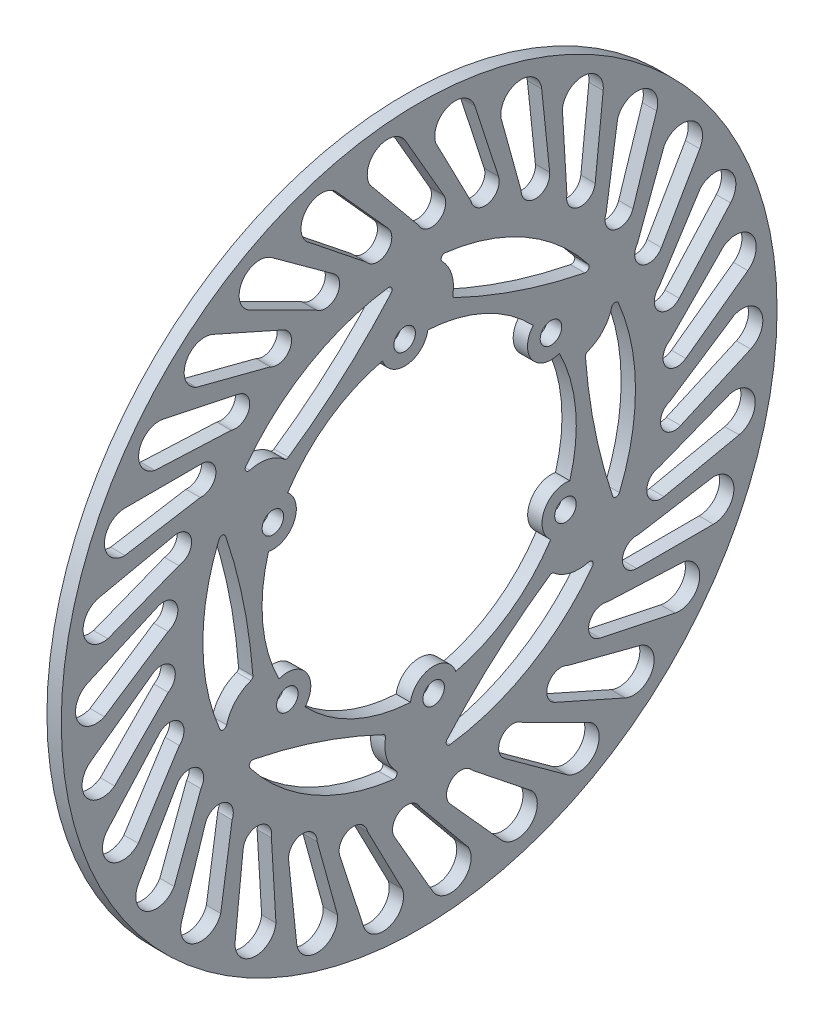
from build123d import *

# Parameters (mm, degrees)
SKETCH1_R           = 99.906578291
SKETCH1_R_2         = 3
BOSS_EXTRUDE1_DEPTH = 2


with BuildPart() as part:
    # Sketch1 → Boss-Extrude1 (new, symmetric)
    with BuildSketch(Plane(origin=(0, 0, 0), x_dir=(0, 0, -1), z_dir=(1, 0, 0))):
        Circle(SKETCH1_R)
        with Locations((-4.044070931, 44.817914837)):
            Circle(SKETCH1_R_2, mode=Mode.SUBTRACT)
        with Locations((36.791417327, 25.91122558)):
            Circle(SKETCH1_R_2, mode=Mode.SUBTRACT)
        with Locations((40.835488259, -18.906689257)):
            Circle(SKETCH1_R_2, mode=Mode.SUBTRACT)
        with Locations((4.044070931, -44.817914837)):
            Circle(SKETCH1_R_2, mode=Mode.SUBTRACT)
        with Locations((-36.791417327, -25.91122558)):
            Circle(SKETCH1_R_2, mode=Mode.SUBTRACT)
        with Locations((-40.835488259, 18.906689257)):
            Circle(SKETCH1_R_2, mode=Mode.SUBTRACT)
        with BuildLine():
            Line((68.395311045, 55.33618476), (60.910541792, 35.407384567))
            ThreePointArc((60.910541792, 35.407384567), (62.001866488, 29.722507233), (67.626015384, 31.092824384))
            Line((67.626015384, 31.092824384), (78.327802866, 49.629773187))
            ThreePointArc((78.327802866, 49.629773187), (76.214762742, 57.449224884), (68.395311045, 55.33618476))
        make_face(mode=Mode.SUBTRACT)
        with BuildLine():
            Line((66.297564201, 64.830555157), (59.683684819, 44.47365643))
            ThreePointArc((59.683684819, 44.47365643), (54.467342027, 41.963957689), (52.217912935, 47.297707652))
            Line((52.217912935, 47.297707652), (55.395691478, 68.347186776))
            ThreePointArc((55.395691478, 68.347186776), (62.604943649, 72.039807328), (66.297564201, 64.830555157))
        make_face(mode=Mode.SUBTRACT)
        with BuildLine():
            Line((78.405718306, 39.90673147), (66.941078676, 21.969594407))
            ThreePointArc((66.941078676, 21.969594407), (66.82660285, 16.182046119), (72.612755554, 16.353092246))
            Line((72.612755554, 16.353092246), (86.934731672, 32.259937513))
            ThreePointArc((86.934731672, 32.259937513), (86.493621968, 40.347841175), (78.405718306, 39.90673147))
        make_face(mode=Mode.SUBTRACT)
        with BuildLine():
            Line((84.98941043, 22.733168054), (70.045960187, 7.571633082))
            ThreePointArc((70.045960187, 7.571633082), (68.730686982, 1.934357473), (74.425960857, 0.89865704))
            Line((74.425960857, 0.89865704), (91.742186529, 13.480193302))
            ThreePointArc((91.742186529, 13.480193302), (92.992285856, 21.483068728), (84.98941043, 22.733168054))
        make_face(mode=Mode.SUBTRACT)
        with BuildLine():
            Line((87.858648477, 4.566061642), (70.089488103, -7.157239408))
            ThreePointArc((70.089488103, -7.157239408), (67.63090127, -12.397866344), (72.986385519, -14.595048258))
            Line((72.986385519, -14.595048258), (92.540058591, -5.888694508))
            ThreePointArc((92.540058591, -5.888694508), (95.426731609, 1.679388624), (87.858648477, 4.566061642))
        make_face(mode=Mode.SUBTRACT)
        with BuildLine():
            Line((86.888032977, -13.800598041), (67.069760048, -21.573300658))
            ThreePointArc((67.069760048, -21.573300658), (63.575311629, -26.188238376), (68.35694589, -29.45087438))
            Line((68.35694589, -29.45087438), (89.293477021, -25.000212578))
            ThreePointArc((89.293477021, -25.000212578), (93.690562268, -18.197683288), (86.888032977, -13.800598041))
        make_face(mode=Mode.SUBTRACT)
        with BuildLine():
            Line((82.119984486, -31.564099834), (61.118752626, -35.046499616))
            ThreePointArc((61.118752626, -35.046499616), (56.741166785, -38.834053194), (60.739970697, -43.019550436))
            Line((60.739970697, -43.019550436), (82.144333011, -43.019095861))
            ThreePointArc((82.144333011, -43.019095861), (87.859656762, -37.279423585), (82.119984486, -31.564099834))
        make_face(mode=Mode.SUBTRACT)
        with BuildLine():
            Line((73.762889601, -47.94809347), (52.496553418, -46.987992836))
            ThreePointArc((52.496553418, -46.987992836), (47.427151662, -49.782628007), (50.468358306, -54.708060175))
            Line((50.468358306, -54.708060175), (71.40507846, -59.157832692))
            ThreePointArc((71.40507846, -59.157832692), (78.188853642, -54.731868652), (73.762889601, -47.94809347))
        make_face(mode=Mode.SUBTRACT)
        with BuildLine():
            Line((62.181993472, -62.236519807), (41.579993903, -56.875879763))
            ThreePointArc((41.579993903, -56.875879763), (36.040333415, -58.555457559), (37.991027467, -64.005559633))
            Line((37.991027467, -64.005559633), (57.545070325, -72.711082832))
            ThreePointArc((57.545070325, -72.711082832), (65.100813411, -69.792262892), (62.181993472, -62.236519807))
        make_face(mode=Mode.SUBTRACT)
        with BuildLine():
            Line((47.883436829, -73.804906052), (28.846180117, -64.278012289))
            ThreePointArc((28.846180117, -64.278012289), (23.078370642, -64.769127102), (23.853297411, -70.505703468))
            Line((23.853297411, -70.505703468), (41.17005747, -83.086504211))
            ThreePointArc((41.17005747, -83.086504211), (49.167546229, -81.802394811), (47.883436829, -73.804906052))
        make_face(mode=Mode.SUBTRACT)
        with BuildLine():
            Line((31.492135211, -82.147658213), (14.851640824, -68.870881706))
            ThreePointArc((14.851640824, -68.870881706), (9.107763313, -68.152069462), (8.673054782, -73.924404205))
            Line((8.673054782, -73.924404205), (22.995706531, -89.830641131))
            ThreePointArc((22.995706531, -89.830641131), (31.08541233, -90.237364012), (31.492135211, -82.147658213))
        make_face(mode=Mode.SUBTRACT)
        with BuildLine():
            Line((13.724467152, -86.90015799), (0.208004545, -70.453757579))
            ThreePointArc((0.208004545, -70.453757579), (-5.260905992, -68.556433822), (-6.886250976, -74.112248216))
            Line((-6.886250976, -74.112248216), (3.816323855, -92.648742444))
            ThreePointArc((3.816323855, -92.648742444), (11.644687731, -94.728521865), (13.724467152, -86.90015799))
        make_face(mode=Mode.SUBTRACT)
        with BuildLine():
            Line((-4.643034994, -87.854698336), (-14.444731547, -68.957460639))
            ThreePointArc((-14.444731547, -68.957460639), (-19.399657477, -65.964547521), (-22.144603537, -71.061025817))
            Line((-22.144603537, -71.061025817), (-15.529859501, -91.417643601))
            ThreePointArc((-15.529859501, -91.417643601), (-8.304974615, -95.079583222), (-4.643034994, -87.854698336))
        make_face(mode=Mode.SUBTRACT)
        with BuildLine():
            Line((-22.807623247, -84.969561257), (-28.466172572, -64.44738624))
            ThreePointArc((-28.466172572, -64.44738624), (-32.690559855, -60.489688428), (-36.435139678, -64.904090068))
            Line((-36.435139678, -64.904090068), (-34.197322493, -86.19114953))
            ThreePointArc((-34.197322493, -86.19114953), (-27.891678734, -91.275205016), (-22.807623247, -84.969561257))
        make_face(mode=Mode.SUBTRACT)
        with BuildLine():
            Line((-39.975417937, -78.37084109), (-41.243514276, -57.120646277))
            ThreePointArc((-41.243514276, -57.120646277), (-44.552736918, -52.371134155), (-49.133294396, -55.910528606))
            Line((-49.133294396, -55.910528606), (-51.370207411, -77.197683099))
            ThreePointArc((-51.370207411, -77.197683099), (-46.259391669, -83.481656831), (-39.975417937, -78.37084109))
        make_face(mode=Mode.SUBTRACT)
        with BuildLine():
            Line((-55.396104056, -68.346933568), (-52.218325513, -47.297454443))
            ThreePointArc((-52.218325513, -47.297454443), (-54.467754605, -41.963704481), (-59.684097397, -44.473403221))
            Line((-59.684097397, -44.473403221), (-66.297976779, -64.830301949))
            ThreePointArc((-66.297976779, -64.830301949), (-62.605356227, -72.03955412), (-55.396104056, -68.346933568))
        make_face(mode=Mode.SUBTRACT)
        with BuildLine():
            Line((-68.395723623, -55.335931552), (-60.91095437, -35.407131359))
            ThreePointArc((-60.91095437, -35.407131359), (-62.002279066, -29.722254025), (-67.626427962, -31.092571176))
            Line((-67.626427962, -31.092571176), (-78.328215444, -49.629519979))
            ThreePointArc((-78.328215444, -49.629519979), (-76.21517532, -57.448971676), (-68.395723623, -55.335931552))
        make_face(mode=Mode.SUBTRACT)
        with BuildLine():
            Line((-78.406130884, -39.906478262), (-66.941491254, -21.969341198))
            ThreePointArc((-66.941491254, -21.969341198), (-66.827015428, -16.181792911), (-72.613168132, -16.352839038))
            Line((-72.613168132, -16.352839038), (-86.93514425, -32.259684305))
            ThreePointArc((-86.93514425, -32.259684305), (-86.494034546, -40.347587966), (-78.406130884, -39.906478262))
        make_face(mode=Mode.SUBTRACT)
        with BuildLine():
            Line((-84.989823008, -22.732914846), (-70.046372765, -7.571379874))
            ThreePointArc((-70.046372765, -7.571379874), (-68.73109956, -1.934104265), (-74.426373435, -0.898403832))
            Line((-74.426373435, -0.898403832), (-91.742599107, -13.479940094))
            ThreePointArc((-91.742599107, -13.479940094), (-92.992698434, -21.48281552), (-84.989823008, -22.732914846))
        make_face(mode=Mode.SUBTRACT)
        with BuildLine():
            Line((-87.859061055, -4.565808434), (-70.089900681, 7.157492616))
            ThreePointArc((-70.089900681, 7.157492616), (-67.631313848, 12.398119552), (-72.986798097, 14.595301466))
            Line((-72.986798097, 14.595301466), (-92.540471169, 5.888947716))
            ThreePointArc((-92.540471169, 5.888947716), (-95.427144187, -1.679135416), (-87.859061055, -4.565808434))
        make_face(mode=Mode.SUBTRACT)
        with BuildLine():
            Line((-86.888445556, 13.800851249), (-67.070172626, 21.573553866))
            ThreePointArc((-67.070172626, 21.573553866), (-63.575724207, 26.188491585), (-68.357358468, 29.451127588))
            Line((-68.357358468, 29.451127588), (-89.293889599, 25.000465786))
            ThreePointArc((-89.293889599, 25.000465786), (-93.690974846, 18.197936496), (-86.888445556, 13.800851249))
        make_face(mode=Mode.SUBTRACT)
        with BuildLine():
            Line((-82.120397064, 31.564353042), (-61.119165204, 35.046752824))
            ThreePointArc((-61.119165204, 35.046752824), (-56.741579363, 38.834306402), (-60.740383275, 43.019803644))
            Line((-60.740383275, 43.019803644), (-82.144745589, 43.019349069))
            ThreePointArc((-82.144745589, 43.019349069), (-87.86006934, 37.279676793), (-82.120397064, 31.564353042))
        make_face(mode=Mode.SUBTRACT)
        with BuildLine():
            Line((-73.763302179, 47.948346678), (-52.496965996, 46.988246044))
            ThreePointArc((-52.496965996, 46.988246044), (-47.42756424, 49.782881215), (-50.468770884, 54.708313383))
            Line((-50.468770884, 54.708313383), (-71.405491038, 59.158085901))
            ThreePointArc((-71.405491038, 59.158085901), (-78.18926622, 54.73212186), (-73.763302179, 47.948346678))
        make_face(mode=Mode.SUBTRACT)
        with BuildLine():
            Line((-62.18240605, 62.236773015), (-41.580406481, 56.876132971))
            ThreePointArc((-41.580406481, 56.876132971), (-36.040745993, 58.555710767), (-37.991440045, 64.005812841))
            Line((-37.991440045, 64.005812841), (-57.545482903, 72.71133604))
            ThreePointArc((-57.545482903, 72.71133604), (-65.101225989, 69.792516101), (-62.18240605, 62.236773015))
        make_face(mode=Mode.SUBTRACT)
        with BuildLine():
            Line((-47.883849407, 73.80515926), (-28.846592695, 64.278265497))
            ThreePointArc((-28.846592695, 64.278265497), (-23.07878322, 64.769380311), (-23.853709989, 70.505956676))
            Line((-23.853709989, 70.505956676), (-41.170470048, 83.08675742))
            ThreePointArc((-41.170470048, 83.08675742), (-49.167958807, 81.802648019), (-47.883849407, 73.80515926))
        make_face(mode=Mode.SUBTRACT)
        with BuildLine():
            Line((-31.492547789, 82.147911422), (-14.852053402, 68.871134914))
            ThreePointArc((-14.852053402, 68.871134914), (-9.108175891, 68.15232267), (-8.67346736, 73.924657413))
            Line((-8.67346736, 73.924657413), (-22.996119109, 89.830894339))
            ThreePointArc((-22.996119109, 89.830894339), (-31.085824908, 90.23761722), (-31.492547789, 82.147911422))
        make_face(mode=Mode.SUBTRACT)
        with BuildLine():
            Line((-13.72487973, 86.900411198), (-0.208417123, 70.454010787))
            ThreePointArc((-0.208417123, 70.454010787), (5.260493414, 68.55668703), (6.885838398, 74.112501424))
            Line((6.885838398, 74.112501424), (-3.816736433, 92.648995652))
            ThreePointArc((-3.816736433, 92.648995652), (-11.645100309, 94.728775074), (-13.72487973, 86.900411198))
        make_face(mode=Mode.SUBTRACT)
        with BuildLine():
            Line((4.642622416, 87.854951544), (14.444318969, 68.957713847))
            ThreePointArc((14.444318969, 68.957713847), (19.399244899, 65.964800729), (22.144190959, 71.061279026))
            Line((22.144190959, 71.061279026), (15.529446923, 91.41789681))
            ThreePointArc((15.529446923, 91.41789681), (8.304562037, 95.07983643), (4.642622416, 87.854951544))
        make_face(mode=Mode.SUBTRACT)
        with BuildLine():
            Line((22.807210669, 84.969814465), (28.465759994, 64.447639448))
            ThreePointArc((28.465759994, 64.447639448), (32.690147277, 60.489941636), (36.4347271, 64.904343276))
            Line((36.4347271, 64.904343276), (34.196909915, 86.191402738))
            ThreePointArc((34.196909915, 86.191402738), (27.891266156, 91.275458225), (22.807210669, 84.969814465))
        make_face(mode=Mode.SUBTRACT)
        with BuildLine():
            Line((39.975005359, 78.371094298), (41.243101698, 57.120899485))
            ThreePointArc((41.243101698, 57.120899485), (44.55232434, 52.371387363), (49.132881818, 55.910781814))
            Line((49.132881818, 55.910781814), (51.369794833, 77.197936307))
            ThreePointArc((51.369794833, 77.197936307), (46.258979091, 83.481910039), (39.975005359, 78.371094298))
        make_face(mode=Mode.SUBTRACT)
        with BuildLine():
            ThreePointArc((42.050967868, -12.470116058), (43.68352784, 3.941711384), (39.139469671, 19.796201833))
            ThreePointArc((39.139469671, 19.796201833), (31.435949706, 22.139510879), (31.824921228, 30.182148399))
            ThreePointArc((31.824921228, 30.182148399), (18.428141727, 39.801900528), (2.425721149, 43.793875942))
            ThreePointArc((2.425721149, 43.793875942), (-3.455403995, 38.294086477), (-10.22604664, 42.652264457))
            ThreePointArc((-10.22604664, 42.652264457), (-25.255386113, 35.860189144), (-36.713748522, 23.997674109))
            ThreePointArc((-36.713748522, 23.997674109), (-34.891353701, 16.154575599), (-42.050967868, 12.470116058))
            ThreePointArc((-42.050967868, 12.470116058), (-43.68352784, -3.941711384), (-39.139469671, -19.796201833))
            ThreePointArc((-39.139469671, -19.796201833), (-31.435949706, -22.139510879), (-31.824921228, -30.182148399))
            ThreePointArc((-31.824921228, -30.182148399), (-18.428141727, -39.801900528), (-2.425721149, -43.793875942))
            ThreePointArc((-2.425721149, -43.793875942), (3.455403995, -38.294086477), (10.22604664, -42.652264457))
            ThreePointArc((10.22604664, -42.652264457), (25.255386113, -35.860189144), (36.713748522, -23.997674109))
            ThreePointArc((36.713748522, -23.997674109), (34.891353701, -16.154575599), (42.050967868, -12.470116058))
        make_face(mode=Mode.SUBTRACT)
        with BuildLine():
            ThreePointArc((-7.789552071, 57.885939), (-21.367529891, 44.293280073), (-36.532464532, 32.497237697))
            ThreePointArc((-36.532464532, 32.497237697), (-37.064561002, 32.348231345), (-37.578078202, 32.552264754))
            ThreePointArc((-37.578078202, 32.552264754), (-42.171569684, 34.844125271), (-47.304115427, 34.745318296))
            ThreePointArc((-47.304115427, 34.745318296), (-48.390687003, 35.152729359), (-48.360601063, 36.31277953))
            ThreePointArc((-48.360601063, 36.31277953), (-30.848794068, 51.910987324), (-8.672423524, 59.538310583))
            ThreePointArc((-8.672423524, 59.538310583), (-7.657754935, 59.018406342), (-7.789552071, 57.885939))
        make_face(mode=Mode.SUBTRACT)
        with BuildLine():
            ThreePointArc((46.235917661, 35.688919478), (27.675340814, 40.651463738), (9.877201133, 47.886661197))
            ThreePointArc((9.877201133, 47.886661197), (9.482109611, 48.272967081), (9.402049126, 48.819702725))
            ThreePointArc((9.402049126, 48.819702725), (9.090112815, 53.943713299), (6.438270593, 58.339224811))
            ThreePointArc((6.438270593, 58.339224811), (6.247813136, 59.483928931), (7.267489024, 60.037898828))
            ThreePointArc((7.267489024, 60.037898828), (29.531836724, 52.671333001), (47.225477701, 37.279694376))
            ThreePointArc((47.225477701, 37.279694376), (47.282561716, 36.141013481), (46.235917661, 35.688919478))
        make_face(mode=Mode.SUBTRACT)
        with BuildLine():
            ThreePointArc((54.025469732, -22.197019523), (49.042870705, -3.641816335), (46.409665665, 15.389423499))
            ThreePointArc((46.409665665, 15.389423499), (46.546670614, 15.924735736), (46.980127328, 16.267437972))
            ThreePointArc((46.980127328, 16.267437972), (51.261682499, 19.099588028), (53.74238602, 23.593906515))
            ThreePointArc((53.74238602, 23.593906515), (54.638500139, 24.331199572), (55.628090087, 23.725119297))
            ThreePointArc((55.628090087, 23.725119297), (60.380630792, 0.760345677), (55.897901225, -22.258616207))
            ThreePointArc((55.897901225, -22.258616207), (54.940316651, -22.877392862), (54.025469732, -22.197019523))
        make_face(mode=Mode.SUBTRACT)
        with BuildLine():
            ThreePointArc((7.789552071, -57.885939), (21.367529891, -44.293280073), (36.532464532, -32.497237697))
            ThreePointArc((36.532464532, -32.497237697), (37.064561002, -32.348231345), (37.578078202, -32.552264754))
            ThreePointArc((37.578078202, -32.552264754), (42.171569684, -34.844125271), (47.304115427, -34.745318296))
            ThreePointArc((47.304115427, -34.745318296), (48.390687003, -35.152729359), (48.360601063, -36.31277953))
            ThreePointArc((48.360601063, -36.31277953), (30.848794068, -51.910987324), (8.672423524, -59.538310583))
            ThreePointArc((8.672423524, -59.538310583), (7.657754935, -59.018406342), (7.789552071, -57.885939))
        make_face(mode=Mode.SUBTRACT)
        with BuildLine():
            ThreePointArc((-46.235917661, -35.688919478), (-27.675340814, -40.651463738), (-9.877201133, -47.886661197))
            ThreePointArc((-9.877201133, -47.886661197), (-9.482109611, -48.272967081), (-9.402049126, -48.819702725))
            ThreePointArc((-9.402049126, -48.819702725), (-9.090112815, -53.943713299), (-6.438270593, -58.339224811))
            ThreePointArc((-6.438270593, -58.339224811), (-6.247813136, -59.483928931), (-7.267489024, -60.037898828))
            ThreePointArc((-7.267489024, -60.037898828), (-29.531836724, -52.671333001), (-47.225477701, -37.279694376))
            ThreePointArc((-47.225477701, -37.279694376), (-47.282561716, -36.141013481), (-46.235917661, -35.688919478))
        make_face(mode=Mode.SUBTRACT)
        with BuildLine():
            ThreePointArc((-54.025469732, 22.197019523), (-49.042870705, 3.641816335), (-46.409665665, -15.389423499))
            ThreePointArc((-46.409665665, -15.389423499), (-46.546670614, -15.924735736), (-46.980127328, -16.267437972))
            ThreePointArc((-46.980127328, -16.267437972), (-51.261682499, -19.099588028), (-53.74238602, -23.593906515))
            ThreePointArc((-53.74238602, -23.593906515), (-54.638500139, -24.331199572), (-55.628090087, -23.725119297))
            ThreePointArc((-55.628090087, -23.725119297), (-60.380630792, -0.760345677), (-55.897901225, 22.258616207))
            ThreePointArc((-55.897901225, 22.258616207), (-54.940316651, 22.877392862), (-54.025469732, 22.197019523))
        make_face(mode=Mode.SUBTRACT)
    extrude(amount=BOSS_EXTRUDE1_DEPTH, both=True)


solid = part.part
